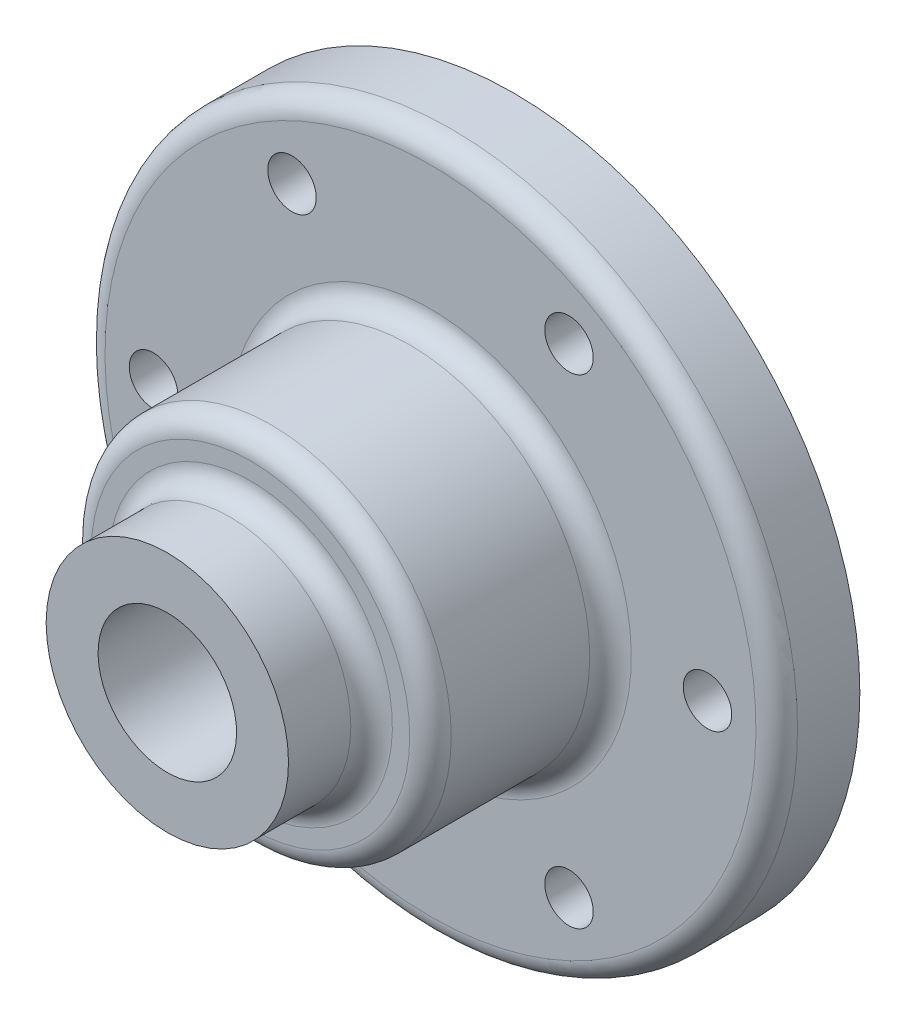
from build123d import *

# Parameters (mm, degrees)
F_7_0_7_DIAMETER_HOLE1_D = 7
CIRPATTERN1_COUNT        = 6
FILLET1_R                = 3


with BuildPart() as part:
    # Sketch1 → Revolve1 (revolve)
    with BuildSketch(Plane(origin=(0, 0, 0), x_dir=(0, 0, -1), z_dir=(1, 0, 0))):
        Polygon((-50, 17.5), (-50, 10), (-10, 10), (-10, 20), (0, 20), (0, 50), (-12, 50), (-12, 26), (-38, 26), (-38, 17.5), align=None)
    revolve(axis=Axis((0, 0, 0), (0, 0, 1)))

    # Ø7.0 (7) Diameter Hole1 (through all)
    with Locations(Plane.XY.offset(12)):
        with Locations((40, 0)):
            f_7_0_7_diameter_hole1 = Hole(F_7_0_7_DIAMETER_HOLE1_D / 2)

    # CirPattern1: Ø7.0 (7) Diameter Hole1 ×6 about axis
    cirpattern1_axis = Axis((0, 0, 0), (0, 0, 1))
    for i in range(1, CIRPATTERN1_COUNT):
        add(f_7_0_7_diameter_hole1.rotate(cirpattern1_axis, i * 360 / CIRPATTERN1_COUNT), mode=Mode.SUBTRACT)

    # Fillet1
    fillet1_edges = [part.edges().sort_by_distance(p)[0] for p in [
        (0, -17.5, 38),
        (0, -26, 38),
        (0, -26, 12),
        (0, -50, 12),
    ]]
    fillet(fillet1_edges, radius=FILLET1_R)

    # Groove Sketch → O-Ring Groove (revolve, cut)
    with BuildSketch(Plane.ZX, mode=Mode.PRIVATE) as o_ring_groove_sk:
        with BuildLine():
            Line((2.075, 27.25), (0, 27.25))
            Line((0, 27.25), (0, 30.8))
            Line((0, 30.8), (2.075, 30.8))
            ThreePointArc((2.075, 30.8), (2.499264069, 30.624264069), (2.675, 30.2))
            Line((2.675, 30.2), (2.675, 27.85))
            ThreePointArc((2.675, 27.85), (2.499264069, 27.425735931), (2.075, 27.25))
        make_face()
    revolve(o_ring_groove_sk.sketch.rotate(Axis((0, 0, -50), (0, 0, 1)), 270), axis=Axis((0, 0, -50), (0, 0, 1)), mode=Mode.SUBTRACT)


solid = part.part
